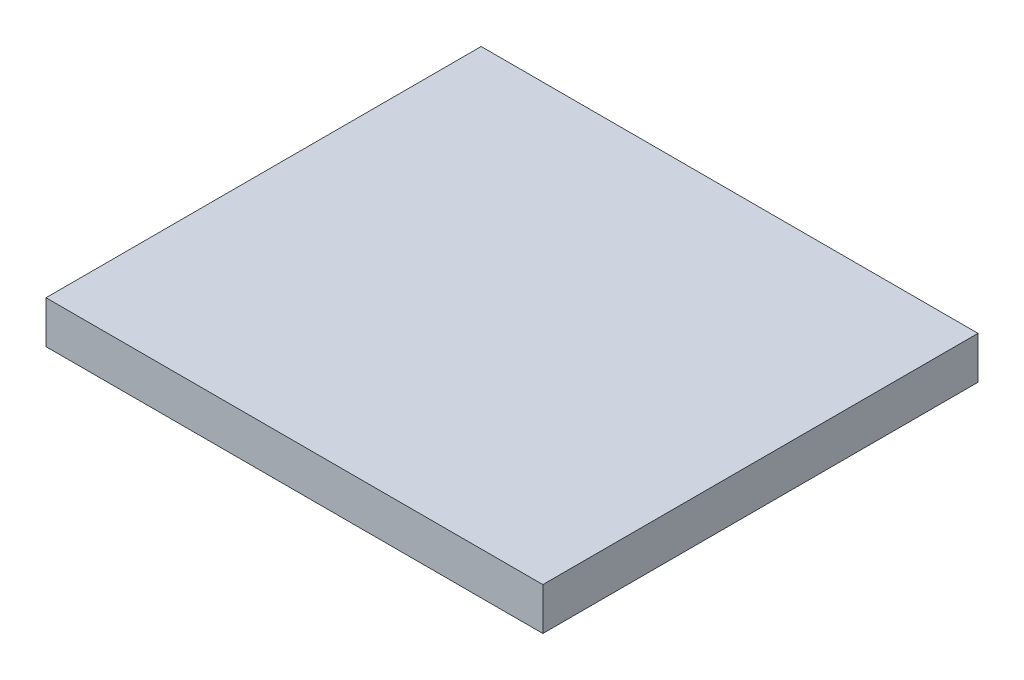
from build123d import *

# Parameters (mm, degrees)
SKETCH1_W           = 58.613938198
SKETCH1_H           = 51.33772518
BOSS_EXTRUDE1_DEPTH = 5


with BuildPart() as part:
    # Sketch1 → Boss-Extrude1 (new body)
    with BuildSketch(Plane(origin=(0, 0, 0), x_dir=(1, 0, 0), z_dir=(0, 1, 0))):
        Rectangle(SKETCH1_W, SKETCH1_H)
    extrude(amount=BOSS_EXTRUDE1_DEPTH)


solid = part.part
